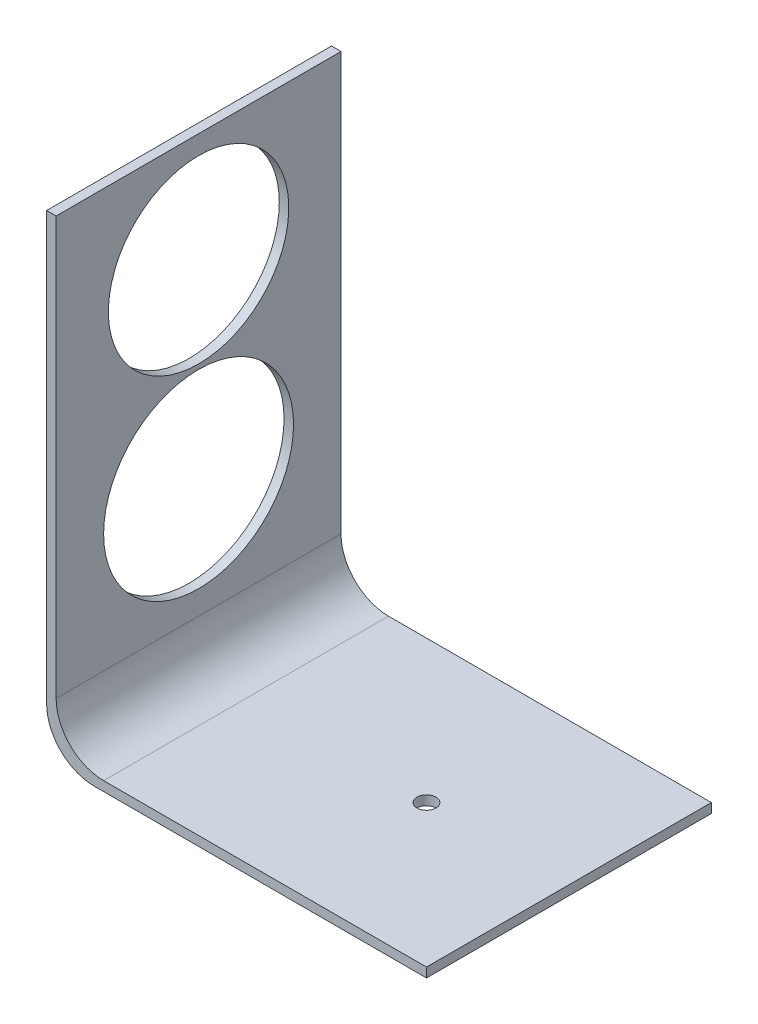
from build123d import *

# Parameters (mm, degrees)
BOSS_EXTRUDE1_DEPTH = 60
SKETCH2_R           = 20
SKETCH2_R_2         = 19
CUT_EXTRUDE1_DEPTH  = 10
SKETCH3_R           = 2
CUT_EXTRUDE2_DEPTH  = 10


with BuildPart() as part:
    # Sketch1 → Boss-Extrude1 (new body)
    with BuildSketch(Plane.XY):
        with BuildLine():
            Line((-24.827586207, 75.25862069), (-22.827586207, 75.25862069))
            Line((-22.827586207, 75.25862069), (-22.827586207, -12.74137931))
            ThreePointArc((-22.827586207, -12.74137931), (-19.898654019, -19.812447122), (-12.827586207, -22.74137931))
            Line((-12.827586207, -22.74137931), (55.172413793, -22.74137931))
            Line((55.172413793, -22.74137931), (55.172413793, -24.74137931))
            Line((55.172413793, -24.74137931), (-14.827586207, -24.74137931))
            ThreePointArc((-14.827586207, -24.74137931), (-21.898654019, -21.812447122), (-24.827586207, -14.74137931))
            Line((-24.827586207, -14.74137931), (-24.827586207, 75.25862069))
        make_face()
    extrude(amount=BOSS_EXTRUDE1_DEPTH)

    # Sketch2 → Cut-Extrude1 (cut)
    with BuildSketch(Plane(origin=(-22.827586207, 0, 0), x_dir=(0, 0, -1), z_dir=(1, 0, 0))):
        with Locations(Location((-30, 12.25862069, 0), (0, 0, 90))):
            Circle(SKETCH2_R)
        with Locations(Location((-30, 52.25862069, 0), (0, 0, 90))):
            Circle(SKETCH2_R_2)
    extrude(amount=-CUT_EXTRUDE1_DEPTH, mode=Mode.SUBTRACT)

    # Sketch3 → Cut-Extrude2 (cut)
    with BuildSketch(Plane(origin=(0, -22.74137931, 0), x_dir=(1, 0, 0), z_dir=(0, 1, 0))):
        with Locations(Location((25.172413793, -30, 0), (0, 0, 270))):
            Circle(SKETCH3_R)
    extrude(amount=-CUT_EXTRUDE2_DEPTH, mode=Mode.SUBTRACT)


solid = part.part
